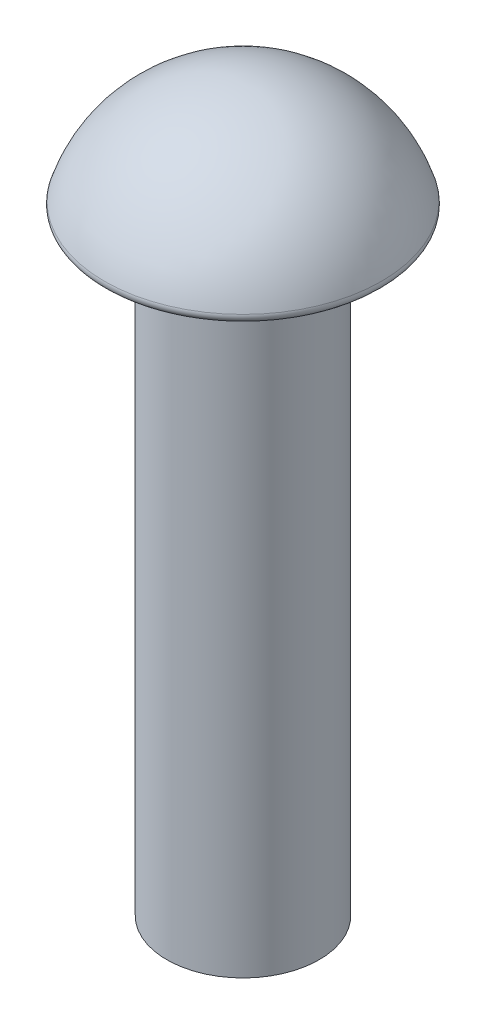
from build123d import *


with BuildPart() as part:
    # Sketch2 → Revolve1 (revolve)
    with BuildSketch(Plane(origin=(0, 0, 0), x_dir=(0, 0, -1), z_dir=(1, 0, 0))):
        with BuildLine():
            Line((0, 0), (0, 13))
            ThreePointArc((0, 13), (1.551381255, 12.491149097), (2.5, 11.162301658))
            ThreePointArc((2.5, 11.162301658), (2.481412105, 11.050965235), (2.380695405, 11))
            Line((2.380695405, 11), (1.375, 11))
            Line((1.375, 11), (1.375, 0))
            Line((1.375, 0), (0, 0))
        make_face()
    revolve(axis=Axis((0, 0, 0), (0, 1, 0)))


solid = part.part
